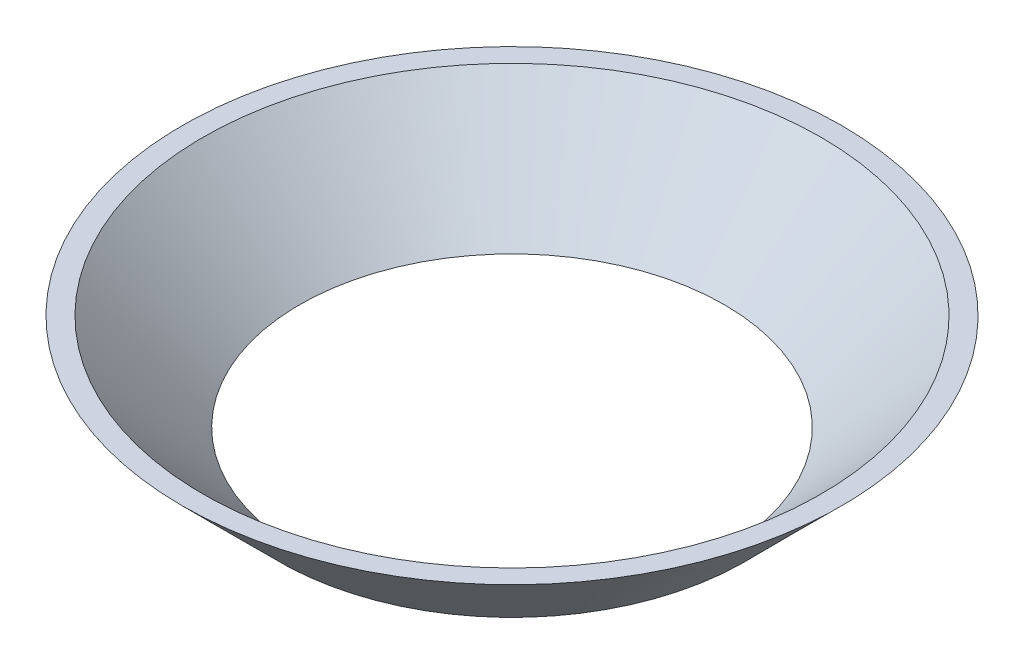
from build123d import *


with BuildPart() as part:
    # Esquisse1 → Révolution1 (revolve)
    with BuildSketch(Plane.XY, mode=Mode.PRIVATE) as r_volution1_sk:
        Polygon((31.8, 0), (45, 13.2), (42.2, 13.2), (29, 0), align=None)
    revolve(r_volution1_sk.sketch.rotate(Axis((0, 0, 0), (0, 1, 0)), 90), axis=Axis((0, 0, 0), (0, 1, 0)))


solid = part.part
